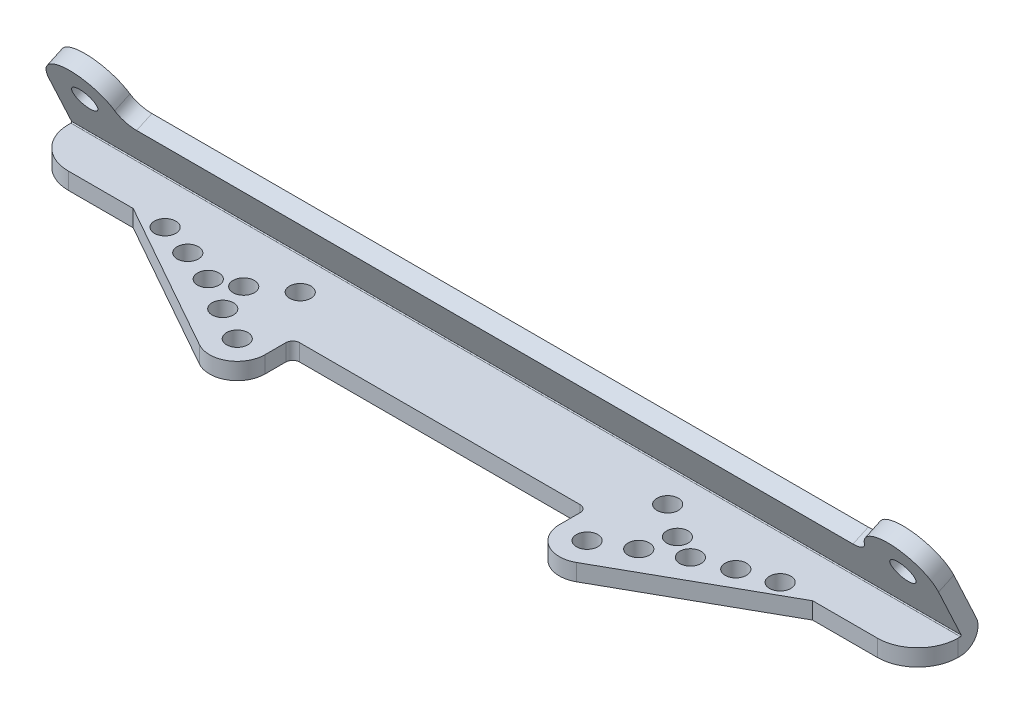
from build123d import *

# Parameters (mm, degrees)
BOSS_EXTRUDE1_DEPTH = 64.15
SKETCH2_R           = 1.75
CUT_EXTRUDE1_DEPTH  = 2.42
CUT_EXTRUDE2_DEPTH  = 2.42
SKETCH4_R           = 1.54
CUT_EXTRUDE3_DEPTH  = 2.42


with BuildPart() as part:
    # Sketch1 → Boss-Extrude1 (new, symmetric)
    with BuildSketch(Plane(origin=(0, 0, 0), x_dir=(0, 0, -1), z_dir=(1, 0, 0))):
        with BuildLine():
            Line((-22.947001366, 0), (-3.987001366, 0))
            ThreePointArc((-3.987001366, 0), (-1.844787094, 1.175258995), (-1.684979587, 3.613450385))
            Line((-1.684979587, 3.613450385), (-7.115854863, 15.26))
            Line((-7.115854863, 15.26), (-9.309119708, 14.237263807))
            Line((-9.309119708, 14.237263807), (-3.878244431, 2.590714191))
            ThreePointArc((-3.878244431, 2.590714191), (-3.885794392, 2.475524047), (-3.987001366, 2.42))
            Line((-3.987001366, 2.42), (-22.947001366, 2.42))
            Line((-22.947001366, 2.42), (-22.947001366, 0))
        make_face()
    extrude(amount=BOSS_EXTRUDE1_DEPTH, both=True)

    # Sketch2 → Cut-Extrude1 (cut)
    with BuildSketch(Plane(origin=(0, 0, 0), x_dir=(-1, 0, 0), z_dir=(0, 0.4226182617407038, -0.9063077870366478))):
        with BuildLine():
            ThreePointArc((-64.15, 11.687547043), (-62.641599916, 15.329146974), (-58.999999979, 16.837547043))
            Line((-58.999999979, 16.837547043), (-64.15, 16.837547043))
            Line((-64.15, 16.837547043), (-64.15, 11.687547043))
        make_face()
        with BuildLine():
            ThreePointArc((54.05757399, 13.134932664), (55.912244813, 15.809229698), (58.999999973, 16.837547043))
            Line((58.999999973, 16.837547043), (-58.999999979, 16.837547043))
            ThreePointArc((-58.999999979, 16.837547043), (-55.912244816, 15.8092297), (-54.05757399, 13.134932664))
            ThreePointArc((-54.05757399, 13.134932664), (-53.157248342, 11.836730217), (-51.658338063, 11.337547043))
            Line((-51.658338063, 11.337547043), (51.658338063, 11.337547043))
            ThreePointArc((51.658338063, 11.337547043), (53.157248342, 11.836730217), (54.05757399, 13.134932664))
        make_face()
        with BuildLine():
            ThreePointArc((58.999999973, 16.837547043), (62.641599913, 15.329146976), (64.15, 11.687547043))
            Line((64.15, 11.687547043), (64.15, 16.837547043))
            Line((64.15, 16.837547043), (58.999999973, 16.837547043))
        make_face()
        with Locations(Location((-59, 11.687547043, 0), (0, 0, 90))):
            Circle(SKETCH2_R)
        with Locations(Location((59, 11.687547043, 0), (0, 0, 90))):
            Circle(SKETCH2_R)
    extrude(amount=-CUT_EXTRUDE1_DEPTH, mode=Mode.SUBTRACT)

    # Sketch3 → Cut-Extrude2 (cut)
    with BuildSketch(Plane.XZ):
        with BuildLine():
            ThreePointArc((-64.15, 4.347001366), (-62.451219331, 8.448220697), (-58.35, 10.147001366))
            Line((-58.35, 10.147001366), (-49, 10.147001366))
            Line((-49, 10.147001366), (-27.188464844, 22.394753573))
            ThreePointArc((-27.188464844, 22.394753573), (-23.20933914, 22.359091991), (-21.23, 18.907001366))
            Line((-21.23, 18.907001366), (-21.23, 15.907001366))
            ThreePointArc((-21.23, 15.907001366), (-20.937106781, 15.199894585), (-20.23, 14.907001366))
            Line((-20.23, 14.907001366), (20.23, 14.907001366))
            ThreePointArc((20.23, 14.907001366), (20.937106781, 15.199894585), (21.23, 15.907001366))
            Line((21.23, 15.907001366), (21.23, 18.907001366))
            ThreePointArc((21.23, 18.907001366), (23.20933914, 22.359091991), (27.188464844, 22.394753573))
            Line((27.188464844, 22.394753573), (49, 10.147001366))
            Line((49, 10.147001366), (58.35, 10.147001366))
            ThreePointArc((58.35, 10.147001366), (62.451219331, 8.448220697), (64.15, 4.347001366))
            Line((64.15, 4.347001366), (64.15, 22.947001366))
            Line((64.15, 22.947001366), (-64.15, 22.947001366))
            Line((-64.15, 22.947001366), (-64.15, 4.347001366))
        make_face()
    extrude(amount=-CUT_EXTRUDE2_DEPTH, mode=Mode.SUBTRACT)

    # Sketch4 → Cut-Extrude3 (cut)
    with BuildSketch(Plane.XZ):
        with Locations(Location((-25.23, 18.907001366, 0), (0, 0, 270))):
            Circle(SKETCH4_R)
        with Locations(Location((-30, 16.228520571, 0), (0, 0, 270))):
            Circle(SKETCH4_R)
        with Locations(Location((-34.77, 13.550039776, 0), (0, 0, 270))):
            Circle(SKETCH4_R)
        with Locations(Location((-31.275605409, 11.933962289, 0), (0, 0, 270))):
            Circle(SKETCH4_R)
        with Locations(Location((-39.521703084, 11.753454736, 0), (0, 0, 270))):
            Circle(SKETCH4_R)
        with Locations(Location((-44.354096024, 10.186809126, 0), (0, 0, 270))):
            Circle(SKETCH4_R)
        with Locations(Location((-26.498719925, 8.557001366, 0), (0, 0, 270))):
            Circle(SKETCH4_R)
    cut_extrude3 = extrude(amount=-CUT_EXTRUDE3_DEPTH, mode=Mode.SUBTRACT)

    # Mirror1: Cut-Extrude3 across plane
    add(cut_extrude3.mirror(Plane(origin=(0, 0, 0), x_dir=(0, 0, 1), z_dir=(1, 0, 0))), mode=Mode.SUBTRACT)


solid = part.part
